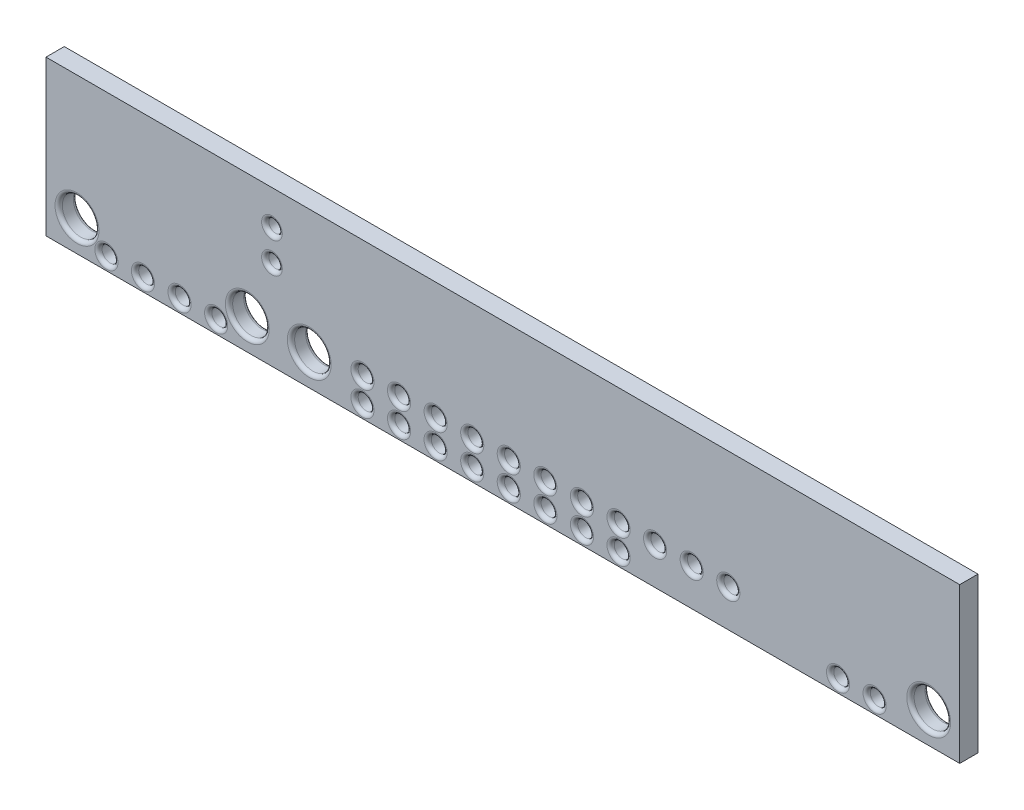
from build123d import *

# Parameters (mm, degrees)
CROQUIS3_W              = 74.93
CROQUIS3_H              = 12.7
SALIENTE_EXTRUIR2_DEPTH = 1.5
CROQUIS4_R              = 1.5
CROQUIS4_R_2            = 0.65
CROQUIS4_R_3            = 0.55
CORTAR_EXTRUIR1_DEPTH   = 3.175
REDONDEO37_R            = 0.3
REDONDEO38_R            = 0.3
REDONDEO39_R            = 0.3
REDONDEO40_R            = 0.3
REDONDEO41_R            = 0.3
REDONDEO42_R            = 0.3
REDONDEO43_R            = 0.3
REDONDEO44_R            = 0.3
REDONDEO45_R            = 0.3
REDONDEO46_R            = 0.3
REDONDEO47_R            = 0.3
REDONDEO48_R            = 0.3
REDONDEO49_R            = 0.3
REDONDEO50_R            = 0.3
REDONDEO51_R            = 0.3
REDONDEO52_R            = 0.3
REDONDEO53_R            = 0.3
REDONDEO54_R            = 0.3
REDONDEO55_R            = 0.3
REDONDEO56_R            = 0.3
REDONDEO57_R            = 0.3
REDONDEO58_R            = 0.3
REDONDEO59_R            = 0.3
REDONDEO60_R            = 0.3
REDONDEO61_R            = 0.3
REDONDEO62_R            = 0.3
REDONDEO63_R            = 0.3
REDONDEO64_R            = 0.3
REDONDEO65_R            = 0.3
REDONDEO66_R            = 0.3
REDONDEO67_R            = 0.3
REDONDEO68_R            = 0.3
REDONDEO69_R            = 0.3
REDONDEO70_R            = 0.3
REDONDEO71_R            = 0.3
REDONDEO72_R            = 0.3
REDONDEO73_R            = 0.3
REDONDEO74_R            = 0.3
REDONDEO75_R            = 0.3
REDONDEO76_R            = 0.3
REDONDEO77_R            = 0.3
REDONDEO78_R            = 0.3
REDONDEO79_R            = 0.3
REDONDEO80_R            = 0.3
REDONDEO81_R            = 0.3
REDONDEO82_R            = 0.3
REDONDEO83_R            = 0.3
REDONDEO84_R            = 0.3
REDONDEO85_R            = 0.3
REDONDEO86_R            = 0.3
REDONDEO87_R            = 0.3
REDONDEO88_R            = 0.3
REDONDEO89_R            = 0.3
REDONDEO90_R            = 0.3
REDONDEO91_R            = 0.3
REDONDEO92_R            = 0.3
REDONDEO93_R            = 0.3
REDONDEO94_R            = 0.3
REDONDEO95_R            = 0.3
REDONDEO96_R            = 0.3
REDONDEO97_R            = 0.3
REDONDEO98_R            = 0.3


with BuildPart() as part:
    # Croquis3 → Saliente-Extruir2 (new body)
    with BuildSketch(Plane.XY):
        Rectangle(CROQUIS3_W, CROQUIS3_H)
    extrude(amount=SALIENTE_EXTRUIR2_DEPTH)

    # Croquis4 → Cortar-Extruir1 (cut)
    with BuildSketch(Plane.XY.offset(1.5)):
        with Locations((-34.925, -3.81)):
            Circle(CROQUIS4_R)
        with Locations((-20.955, -3.81)):
            Circle(CROQUIS4_R)
        with Locations((-15.875, -3.81)):
            Circle(CROQUIS4_R)
        with Locations((34.925, -3.81)):
            Circle(CROQUIS4_R)
        with Locations((-32.512591607, -5.293405739)):
            Circle(CROQUIS4_R_2)
        with Locations((-29.512591607, -5.293405739)):
            Circle(CROQUIS4_R_2)
        with Locations((-26.512591607, -5.293405739)):
            Circle(CROQUIS4_R_2)
        with Locations((-23.512591607, -5.293405739)):
            Circle(CROQUIS4_R_2)
        with Locations((-18.935, 1)):
            Circle(CROQUIS4_R_3)
        with Locations((-18.935, 3.5)):
            Circle(CROQUIS4_R_3)
        with Locations((-11.512591607, -5.293405739)):
            Circle(CROQUIS4_R_2)
        with Locations((-8.512591607, -5.293405739)):
            Circle(CROQUIS4_R_2)
        with Locations((-5.512591607, -5.293405739)):
            Circle(CROQUIS4_R_2)
        with Locations((-2.512591607, -5.293405739)):
            Circle(CROQUIS4_R_2)
        with Locations((0.487408393, -5.293405739)):
            Circle(CROQUIS4_R_2)
        with Locations((3.487408393, -5.293405739)):
            Circle(CROQUIS4_R_2)
        with Locations((6.487408393, -5.293405739)):
            Circle(CROQUIS4_R_2)
        with Locations((9.487408393, -5.293405739)):
            Circle(CROQUIS4_R_2)
        with Locations((27.487408393, -5.293405739)):
            Circle(CROQUIS4_R_2)
        with Locations((30.487408393, -5.293405739)):
            Circle(CROQUIS4_R_2)
        with Locations((-11.512591607, -3.293405739)):
            Circle(CROQUIS4_R_2)
        with Locations((-8.512591607, -3.293405739)):
            Circle(CROQUIS4_R_2)
        with Locations((-5.512591607, -3.293405739)):
            Circle(CROQUIS4_R_2)
        with Locations((-2.512591607, -3.293405739)):
            Circle(CROQUIS4_R_2)
        with Locations((0.487408393, -3.293405739)):
            Circle(CROQUIS4_R_2)
        with Locations((3.487408393, -3.293405739)):
            Circle(CROQUIS4_R_2)
        with Locations((6.487408393, -3.293405739)):
            Circle(CROQUIS4_R_2)
        with Locations((9.487408393, -3.293405739)):
            Circle(CROQUIS4_R_2)
        with Locations((12.487408393, -3.293405739)):
            Circle(CROQUIS4_R_2)
        with Locations((15.487408393, -3.293405739)):
            Circle(CROQUIS4_R_2)
        with Locations((18.487408393, -3.293405739)):
            Circle(CROQUIS4_R_2)
    extrude(amount=-CORTAR_EXTRUIR1_DEPTH, mode=Mode.SUBTRACT)

    # Redondeo37
    redondeo37_edges = [part.edges().sort_by_distance(p)[0] for p in [
        (-36.425, -3.81, 1.5),
    ]]
    fillet(redondeo37_edges, radius=REDONDEO37_R)

    # Redondeo38
    redondeo38_edges = [part.edges().sort_by_distance(p)[0] for p in [
        (-33.162591607, -5.293405739, 1.5),
    ]]
    fillet(redondeo38_edges, radius=REDONDEO38_R)

    # Redondeo39
    redondeo39_edges = [part.edges().sort_by_distance(p)[0] for p in [
        (-30.162591607, -5.293405739, 1.5),
    ]]
    fillet(redondeo39_edges, radius=REDONDEO39_R)

    # Redondeo40
    redondeo40_edges = [part.edges().sort_by_distance(p)[0] for p in [
        (-27.162591607, -5.293405739, 1.5),
    ]]
    fillet(redondeo40_edges, radius=REDONDEO40_R)

    # Redondeo41
    redondeo41_edges = [part.edges().sort_by_distance(p)[0] for p in [
        (-24.162591607, -5.293405739, 1.5),
    ]]
    fillet(redondeo41_edges, radius=REDONDEO41_R)

    # Redondeo42
    redondeo42_edges = [part.edges().sort_by_distance(p)[0] for p in [
        (-22.455, -3.81, 1.5),
    ]]
    fillet(redondeo42_edges, radius=REDONDEO42_R)

    # Redondeo43
    redondeo43_edges = [part.edges().sort_by_distance(p)[0] for p in [
        (-19.485, 1, 1.5),
    ]]
    fillet(redondeo43_edges, radius=REDONDEO43_R)

    # Redondeo44
    redondeo44_edges = [part.edges().sort_by_distance(p)[0] for p in [
        (-19.485, 3.5, 1.5),
    ]]
    fillet(redondeo44_edges, radius=REDONDEO44_R)

    # Redondeo45
    redondeo45_edges = [part.edges().sort_by_distance(p)[0] for p in [
        (-17.375, -3.81, 1.5),
    ]]
    fillet(redondeo45_edges, radius=REDONDEO45_R)

    # Redondeo46
    redondeo46_edges = [part.edges().sort_by_distance(p)[0] for p in [
        (-12.162591607, -5.293405739, 1.5),
    ]]
    fillet(redondeo46_edges, radius=REDONDEO46_R)

    # Redondeo47
    redondeo47_edges = [part.edges().sort_by_distance(p)[0] for p in [
        (-12.162591607, -3.293405739, 1.5),
    ]]
    fillet(redondeo47_edges, radius=REDONDEO47_R)

    # Redondeo48
    redondeo48_edges = [part.edges().sort_by_distance(p)[0] for p in [
        (-9.162591607, -3.293405739, 1.5),
    ]]
    fillet(redondeo48_edges, radius=REDONDEO48_R)

    # Redondeo49
    redondeo49_edges = [part.edges().sort_by_distance(p)[0] for p in [
        (-9.162591607, -5.293405739, 1.5),
    ]]
    fillet(redondeo49_edges, radius=REDONDEO49_R)

    # Redondeo50
    redondeo50_edges = [part.edges().sort_by_distance(p)[0] for p in [
        (-6.162591607, -5.293405739, 1.5),
    ]]
    fillet(redondeo50_edges, radius=REDONDEO50_R)

    # Redondeo51
    redondeo51_edges = [part.edges().sort_by_distance(p)[0] for p in [
        (-6.162591607, -3.293405739, 1.5),
    ]]
    fillet(redondeo51_edges, radius=REDONDEO51_R)

    # Redondeo52
    redondeo52_edges = [part.edges().sort_by_distance(p)[0] for p in [
        (-3.162591607, -5.293405739, 1.5),
    ]]
    fillet(redondeo52_edges, radius=REDONDEO52_R)

    # Redondeo53
    redondeo53_edges = [part.edges().sort_by_distance(p)[0] for p in [
        (-3.162591607, -3.293405739, 1.5),
    ]]
    fillet(redondeo53_edges, radius=REDONDEO53_R)

    # Redondeo54
    redondeo54_edges = [part.edges().sort_by_distance(p)[0] for p in [
        (-0.162591607, -3.293405739, 1.5),
    ]]
    fillet(redondeo54_edges, radius=REDONDEO54_R)

    # Redondeo55
    redondeo55_edges = [part.edges().sort_by_distance(p)[0] for p in [
        (-0.162591607, -5.293405739, 1.5),
    ]]
    fillet(redondeo55_edges, radius=REDONDEO55_R)

    # Redondeo56
    redondeo56_edges = [part.edges().sort_by_distance(p)[0] for p in [
        (2.837408393, -5.293405739, 1.5),
    ]]
    fillet(redondeo56_edges, radius=REDONDEO56_R)

    # Redondeo57
    redondeo57_edges = [part.edges().sort_by_distance(p)[0] for p in [
        (2.837408393, -3.293405739, 1.5),
    ]]
    fillet(redondeo57_edges, radius=REDONDEO57_R)

    # Redondeo58
    redondeo58_edges = [part.edges().sort_by_distance(p)[0] for p in [
        (5.837408393, -3.293405739, 1.5),
    ]]
    fillet(redondeo58_edges, radius=REDONDEO58_R)

    # Redondeo59
    redondeo59_edges = [part.edges().sort_by_distance(p)[0] for p in [
        (5.837408393, -5.293405739, 1.5),
    ]]
    fillet(redondeo59_edges, radius=REDONDEO59_R)

    # Redondeo60
    redondeo60_edges = [part.edges().sort_by_distance(p)[0] for p in [
        (8.837408393, -5.293405739, 1.5),
    ]]
    fillet(redondeo60_edges, radius=REDONDEO60_R)

    # Redondeo61
    redondeo61_edges = [part.edges().sort_by_distance(p)[0] for p in [
        (8.837408393, -3.293405739, 1.5),
    ]]
    fillet(redondeo61_edges, radius=REDONDEO61_R)

    # Redondeo62
    redondeo62_edges = [part.edges().sort_by_distance(p)[0] for p in [
        (11.837408393, -3.293405739, 1.5),
    ]]
    fillet(redondeo62_edges, radius=REDONDEO62_R)

    # Redondeo63
    redondeo63_edges = [part.edges().sort_by_distance(p)[0] for p in [
        (14.837408393, -3.293405739, 1.5),
    ]]
    fillet(redondeo63_edges, radius=REDONDEO63_R)

    # Redondeo64
    redondeo64_edges = [part.edges().sort_by_distance(p)[0] for p in [
        (17.837408393, -3.293405739, 1.5),
    ]]
    fillet(redondeo64_edges, radius=REDONDEO64_R)

    # Redondeo65
    redondeo65_edges = [part.edges().sort_by_distance(p)[0] for p in [
        (26.837408393, -5.293405739, 1.5),
    ]]
    fillet(redondeo65_edges, radius=REDONDEO65_R)

    # Redondeo66
    redondeo66_edges = [part.edges().sort_by_distance(p)[0] for p in [
        (29.837408393, -5.293405739, 1.5),
    ]]
    fillet(redondeo66_edges, radius=REDONDEO66_R)

    # Redondeo67
    redondeo67_edges = [part.edges().sort_by_distance(p)[0] for p in [
        (33.425, -3.81, 1.5),
    ]]
    fillet(redondeo67_edges, radius=REDONDEO67_R)

    # Redondeo68
    redondeo68_edges = [part.edges().sort_by_distance(p)[0] for p in [
        (33.425, -3.81, 0),
    ]]
    fillet(redondeo68_edges, radius=REDONDEO68_R)

    # Redondeo69
    redondeo69_edges = [part.edges().sort_by_distance(p)[0] for p in [
        (29.837408393, -5.293405739, 0),
    ]]
    fillet(redondeo69_edges, radius=REDONDEO69_R)

    # Redondeo70
    redondeo70_edges = [part.edges().sort_by_distance(p)[0] for p in [
        (26.837408393, -5.293405739, 0),
    ]]
    fillet(redondeo70_edges, radius=REDONDEO70_R)

    # Redondeo71
    redondeo71_edges = [part.edges().sort_by_distance(p)[0] for p in [
        (17.837408393, -3.293405739, 0),
    ]]
    fillet(redondeo71_edges, radius=REDONDEO71_R)

    # Redondeo72
    redondeo72_edges = [part.edges().sort_by_distance(p)[0] for p in [
        (14.837408393, -3.293405739, 0),
    ]]
    fillet(redondeo72_edges, radius=REDONDEO72_R)

    # Redondeo73
    redondeo73_edges = [part.edges().sort_by_distance(p)[0] for p in [
        (11.837408393, -3.293405739, 0),
    ]]
    fillet(redondeo73_edges, radius=REDONDEO73_R)

    # Redondeo74
    redondeo74_edges = [part.edges().sort_by_distance(p)[0] for p in [
        (8.837408393, -3.293405739, 0),
    ]]
    fillet(redondeo74_edges, radius=REDONDEO74_R)

    # Redondeo75
    redondeo75_edges = [part.edges().sort_by_distance(p)[0] for p in [
        (8.837408393, -5.293405739, 0),
    ]]
    fillet(redondeo75_edges, radius=REDONDEO75_R)

    # Redondeo76
    redondeo76_edges = [part.edges().sort_by_distance(p)[0] for p in [
        (5.837408393, -5.293405739, 0),
    ]]
    fillet(redondeo76_edges, radius=REDONDEO76_R)

    # Redondeo77
    redondeo77_edges = [part.edges().sort_by_distance(p)[0] for p in [
        (5.837408393, -3.293405739, 0),
    ]]
    fillet(redondeo77_edges, radius=REDONDEO77_R)

    # Redondeo78
    redondeo78_edges = [part.edges().sort_by_distance(p)[0] for p in [
        (2.837408393, -3.293405739, 0),
    ]]
    fillet(redondeo78_edges, radius=REDONDEO78_R)

    # Redondeo79
    redondeo79_edges = [part.edges().sort_by_distance(p)[0] for p in [
        (2.837408393, -5.293405739, 0),
    ]]
    fillet(redondeo79_edges, radius=REDONDEO79_R)

    # Redondeo80
    redondeo80_edges = [part.edges().sort_by_distance(p)[0] for p in [
        (-0.162591607, -5.293405739, 0),
    ]]
    fillet(redondeo80_edges, radius=REDONDEO80_R)

    # Redondeo81
    redondeo81_edges = [part.edges().sort_by_distance(p)[0] for p in [
        (-0.162591607, -3.293405739, 0),
    ]]
    fillet(redondeo81_edges, radius=REDONDEO81_R)

    # Redondeo82
    redondeo82_edges = [part.edges().sort_by_distance(p)[0] for p in [
        (-3.162591607, -3.293405739, 0),
    ]]
    fillet(redondeo82_edges, radius=REDONDEO82_R)

    # Redondeo83
    redondeo83_edges = [part.edges().sort_by_distance(p)[0] for p in [
        (-3.162591607, -5.293405739, 0),
    ]]
    fillet(redondeo83_edges, radius=REDONDEO83_R)

    # Redondeo84
    redondeo84_edges = [part.edges().sort_by_distance(p)[0] for p in [
        (-6.162591607, -5.293405739, 0),
    ]]
    fillet(redondeo84_edges, radius=REDONDEO84_R)

    # Redondeo85
    redondeo85_edges = [part.edges().sort_by_distance(p)[0] for p in [
        (-6.162591607, -3.293405739, 0),
    ]]
    fillet(redondeo85_edges, radius=REDONDEO85_R)

    # Redondeo86
    redondeo86_edges = [part.edges().sort_by_distance(p)[0] for p in [
        (-9.162591607, -3.293405739, 0),
    ]]
    fillet(redondeo86_edges, radius=REDONDEO86_R)

    # Redondeo87
    redondeo87_edges = [part.edges().sort_by_distance(p)[0] for p in [
        (-9.162591607, -5.293405739, 0),
    ]]
    fillet(redondeo87_edges, radius=REDONDEO87_R)

    # Redondeo88
    redondeo88_edges = [part.edges().sort_by_distance(p)[0] for p in [
        (-12.162591607, -5.293405739, 0),
    ]]
    fillet(redondeo88_edges, radius=REDONDEO88_R)

    # Redondeo89
    redondeo89_edges = [part.edges().sort_by_distance(p)[0] for p in [
        (-12.162591607, -3.293405739, 0),
    ]]
    fillet(redondeo89_edges, radius=REDONDEO89_R)

    # Redondeo90
    redondeo90_edges = [part.edges().sort_by_distance(p)[0] for p in [
        (-17.375, -3.81, 0),
    ]]
    fillet(redondeo90_edges, radius=REDONDEO90_R)

    # Redondeo91
    redondeo91_edges = [part.edges().sort_by_distance(p)[0] for p in [
        (-19.485, 1, 0),
    ]]
    fillet(redondeo91_edges, radius=REDONDEO91_R)

    # Redondeo92
    redondeo92_edges = [part.edges().sort_by_distance(p)[0] for p in [
        (-19.485, 3.5, 0),
    ]]
    fillet(redondeo92_edges, radius=REDONDEO92_R)

    # Redondeo93
    redondeo93_edges = [part.edges().sort_by_distance(p)[0] for p in [
        (-22.455, -3.81, 0),
    ]]
    fillet(redondeo93_edges, radius=REDONDEO93_R)

    # Redondeo94
    redondeo94_edges = [part.edges().sort_by_distance(p)[0] for p in [
        (-24.162591607, -5.293405739, 0),
    ]]
    fillet(redondeo94_edges, radius=REDONDEO94_R)

    # Redondeo95
    redondeo95_edges = [part.edges().sort_by_distance(p)[0] for p in [
        (-27.162591607, -5.293405739, 0),
    ]]
    fillet(redondeo95_edges, radius=REDONDEO95_R)

    # Redondeo96
    redondeo96_edges = [part.edges().sort_by_distance(p)[0] for p in [
        (-30.162591607, -5.293405739, 0),
    ]]
    fillet(redondeo96_edges, radius=REDONDEO96_R)

    # Redondeo97
    redondeo97_edges = [part.edges().sort_by_distance(p)[0] for p in [
        (-33.162591607, -5.293405739, 0),
    ]]
    fillet(redondeo97_edges, radius=REDONDEO97_R)

    # Redondeo98
    redondeo98_edges = [part.edges().sort_by_distance(p)[0] for p in [
        (-36.425, -3.81, 0),
    ]]
    fillet(redondeo98_edges, radius=REDONDEO98_R)


solid = part.part
